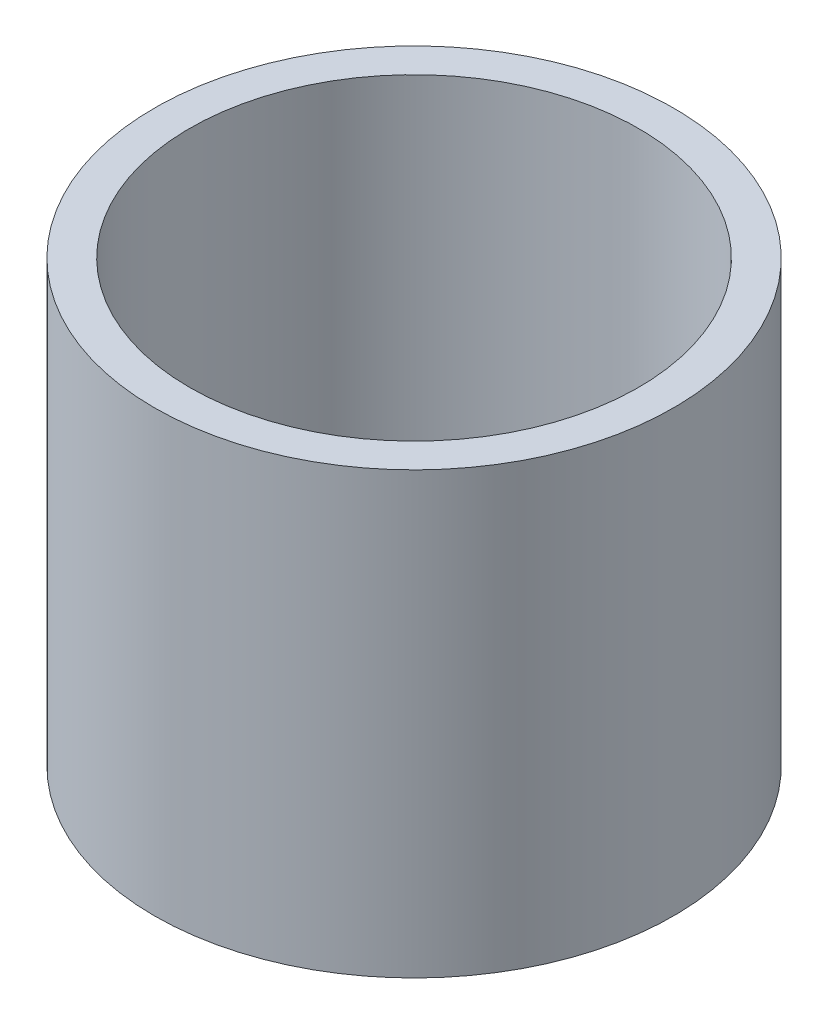
from build123d import *

# Parameters (mm, degrees)
SKETCH1_R           = 5.9
SKETCH1_R_2         = 5.1
BOSS_EXTRUDE1_DEPTH = 10


with BuildPart() as part:
    # Sketch1 → Boss-Extrude1 (new body)
    with BuildSketch(Plane(origin=(0, 0, 0), x_dir=(1, 0, 0), z_dir=(0, 1, 0))):
        with Locations(Location((0, 0, 0), (0, 0, 270))):
            Circle(SKETCH1_R)
        with Locations(Location((0, 0, 0), (0, 0, 270))):
            Circle(SKETCH1_R_2, mode=Mode.SUBTRACT)
    extrude(amount=BOSS_EXTRUDE1_DEPTH)


solid = part.part
